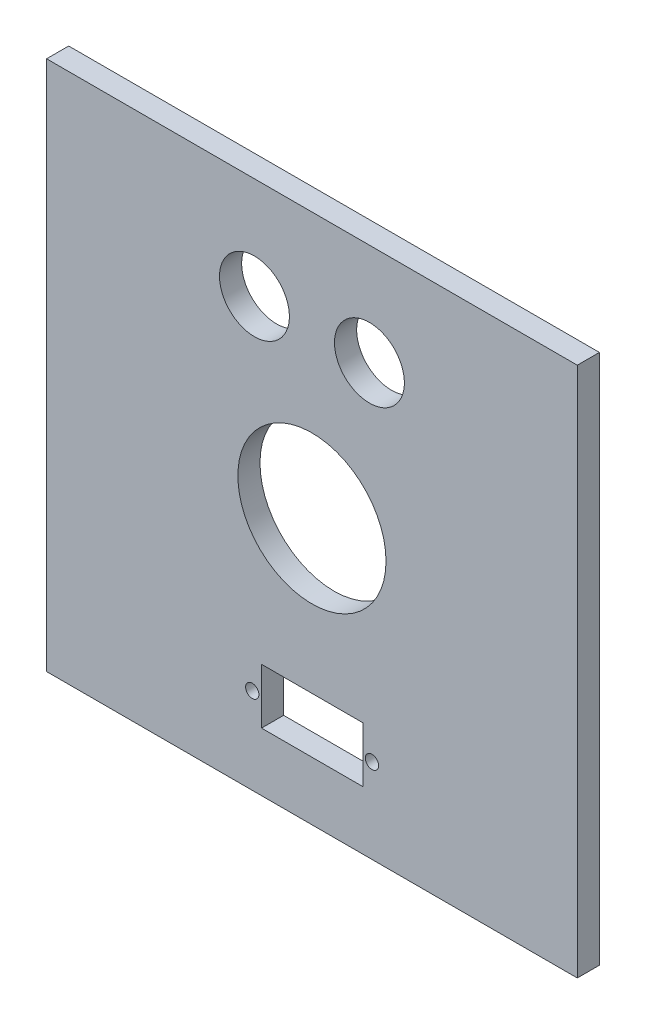
from build123d import *

# Parameters (mm, degrees)
ESBO_O1_W                  = 120
ESBO_O1_H                  = 120
RESSALTO_EXTRUS_O1_DEPTH   = 5
ESBO_O2_R                  = 16.75
CORTE_EXTRUS_O1_DEPTH      = 13
CORTE_EXTRUS_O2_DEPTH      = 28
CORTE_EXTRUS_O2_DEPTH_BACK = 29
ESBO_O3_R                  = 1.5
ESBO_O3_W                  = 22.9
ESBO_O3_H                  = 12.5
CORTE_EXTRUS_O3_DEPTH      = 32
CORTE_EXTRUS_O3_DEPTH_BACK = 28
ESBO_O4_R                  = 7.9


with BuildPart() as part:
    # Esboço1 → Ressalto-extrusão1 (new body)
    with BuildSketch(Plane.XY):
        with Locations((60, 60)):
            Rectangle(ESBO_O1_W, ESBO_O1_H)
    extrude(amount=RESSALTO_EXTRUS_O1_DEPTH)

    # Esboço2 → Corte-extrusão1 (cut)
    with BuildSketch(Plane.XY.offset(5)):
        with Locations((60, 60)):
            Circle(ESBO_O2_R)
    extrude(amount=-CORTE_EXTRUS_O1_DEPTH, mode=Mode.SUBTRACT)

    # Esboço3 → Corte-extrusão2 (cut, two sides: drawn at the far end of the back side and taken through both)
    with BuildSketch(Plane.XY.offset(-CORTE_EXTRUS_O2_DEPTH_BACK)):
        with Locations(Location((46.5, 19.48375, 0), (0, 0, 180))):
            Circle(ESBO_O3_R)
        with Locations(Location((73.566567065, 19.099645167, 0), (0, 0, 180))):
            Circle(ESBO_O3_R)
        with Locations((60.05, 19.48375)):
            Rectangle(ESBO_O3_W, ESBO_O3_H)
    extrude(amount=CORTE_EXTRUS_O2_DEPTH + CORTE_EXTRUS_O2_DEPTH_BACK, mode=Mode.SUBTRACT)

    # Esboço4 → Corte-extrusão3 (cut, two sides: drawn at the far end of the back side and taken through both)
    with BuildSketch(Plane.XY.offset(-CORTE_EXTRUS_O3_DEPTH_BACK)):
        with Locations(Location((47, 96.975019671, 0), (0, 0, 180))):
            Circle(ESBO_O4_R)
        with Locations(Location((73, 96.975019671, 0), (0, 0, 180))):
            Circle(ESBO_O4_R)
    extrude(amount=CORTE_EXTRUS_O3_DEPTH + CORTE_EXTRUS_O3_DEPTH_BACK, mode=Mode.SUBTRACT)


solid = part.part
